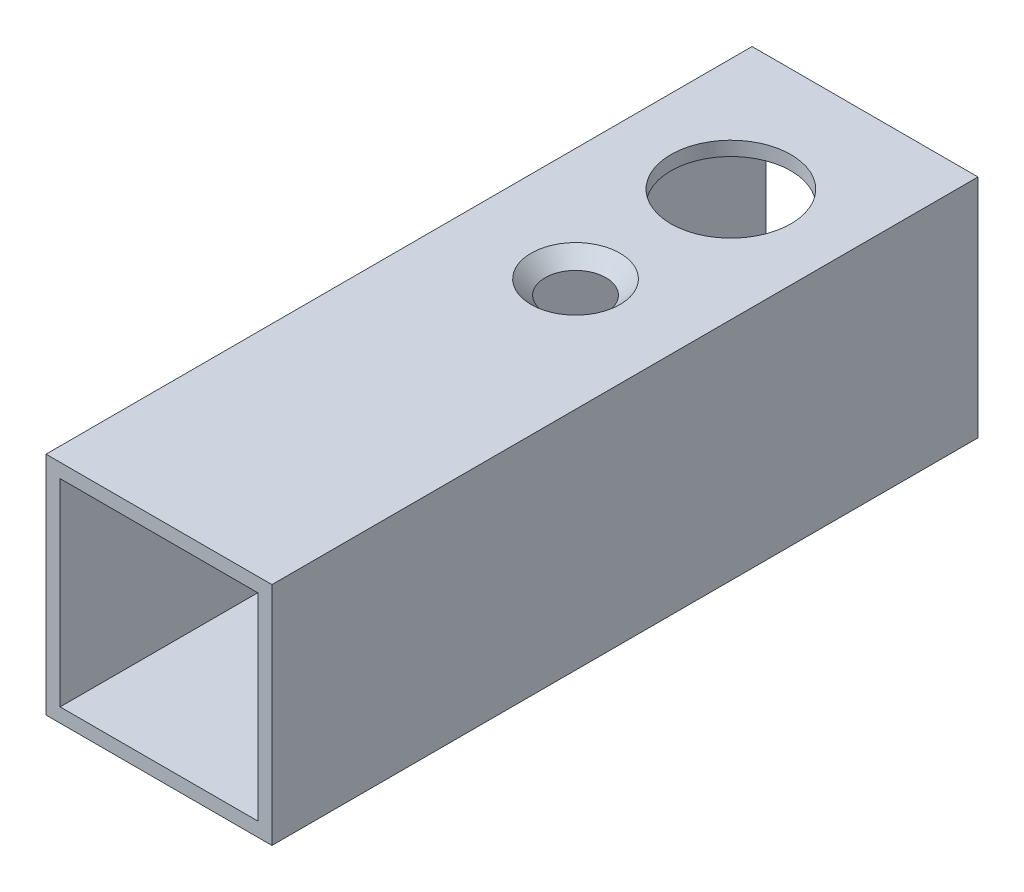
from build123d import *

# Parameters (mm, degrees)
SKETCH1_W                                       = 16
SKETCH1_H                                       = 16
SKETCH1_W_2                                     = 14
SKETCH1_H_2                                     = 14
BOSS_EXTRUDE1_DEPTH                             = 50
SKETCH2_R                                       = 4.25
CUT_EXTRUDE1_DEPTH                              = 54.103672189
CSK_FOR_M3_FLAT_HEAD_MACHINE_SCREW1_D           = 3.4
CSK_FOR_M3_FLAT_HEAD_MACHINE_SCREW1_CSINK_D     = 6.3
CSK_FOR_M3_FLAT_HEAD_MACHINE_SCREW1_CSINK_ANGLE = 90


with BuildPart() as part:
    # Sketch1 → Boss-Extrude1 (new body)
    with BuildSketch(Plane.XY):
        Rectangle(SKETCH1_W, SKETCH1_H)
        Rectangle(SKETCH1_W_2, SKETCH1_H_2, mode=Mode.SUBTRACT)
    extrude(amount=BOSS_EXTRUDE1_DEPTH)

    # Sketch2 → Cut-Extrude1 (cut, through all)
    with BuildSketch(Plane(origin=(0, 8, 0), x_dir=(1, 0, 0), z_dir=(0, 1, 0))):
        with Locations((0, -9.5)):
            Circle(SKETCH2_R)
    extrude(amount=-CUT_EXTRUDE1_DEPTH, mode=Mode.SUBTRACT)

    # CSK for M3 Flat Head Machine Screw1 (through all)
    with Locations(Plane(origin=(0, 8, 20.5), x_dir=(0, 0, 1), z_dir=(0, 1, 0))):
        with Locations((0, 0)):
            csk_for_m3_flat_head_machine_screw1 = CounterSinkHole(CSK_FOR_M3_FLAT_HEAD_MACHINE_SCREW1_D / 2, CSK_FOR_M3_FLAT_HEAD_MACHINE_SCREW1_CSINK_D / 2, counter_sink_angle=CSK_FOR_M3_FLAT_HEAD_MACHINE_SCREW1_CSINK_ANGLE)

    # Mirror1: CSK for M3 Flat Head Machine Screw1 across plane
    add(csk_for_m3_flat_head_machine_screw1.mirror(Plane.ZX), mode=Mode.SUBTRACT)


solid = part.part
